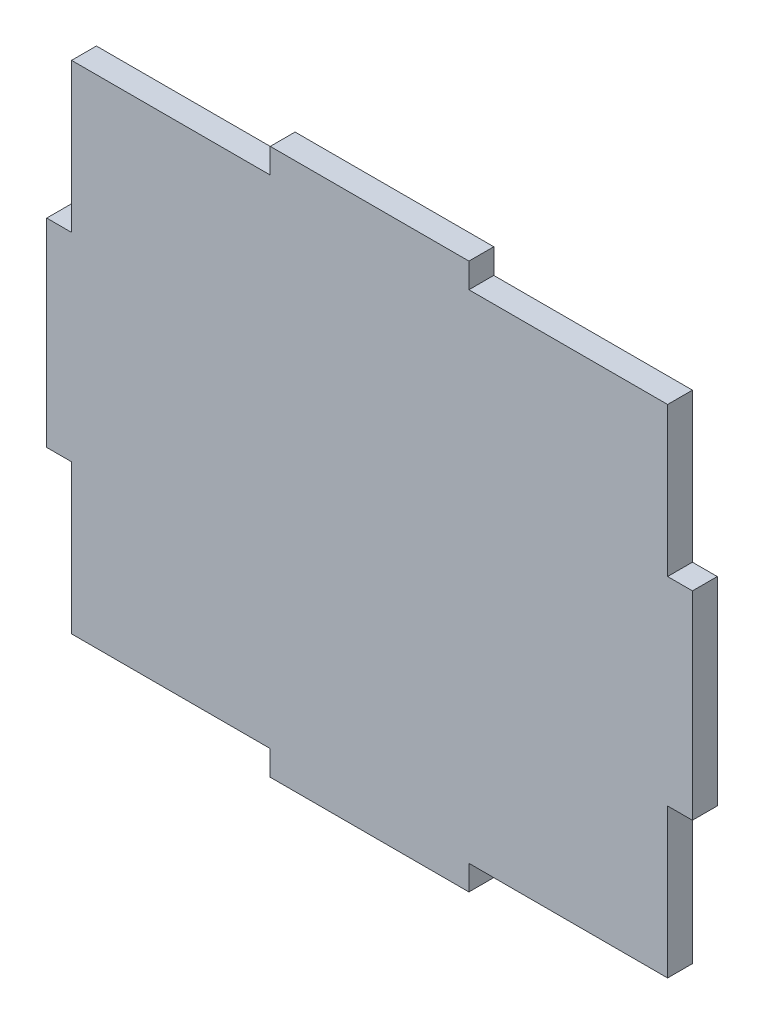
from build123d import *

# Parameters (mm, degrees)
BOSS_EXTRUDE1_DEPTH = 1.25


with BuildPart() as part:
    # Sketch1 → Boss-Extrude1 (new, symmetric)
    with BuildSketch(Plane.XY):
        Polygon((-32.5, 10), (-32.5, -10), (-30, -10), (-30, -25), (-10, -25), (-10, -27.5), (10, -27.5), (10, -25), (30, -25), (30, -10), (32.5, -10), (32.5, 10), (30, 10), (30, 25), (10, 25), (10, 27.5), (-10, 27.5), (-10, 25), (-30, 25), (-30, 10), align=None)
    extrude(amount=BOSS_EXTRUDE1_DEPTH, both=True)


solid = part.part
